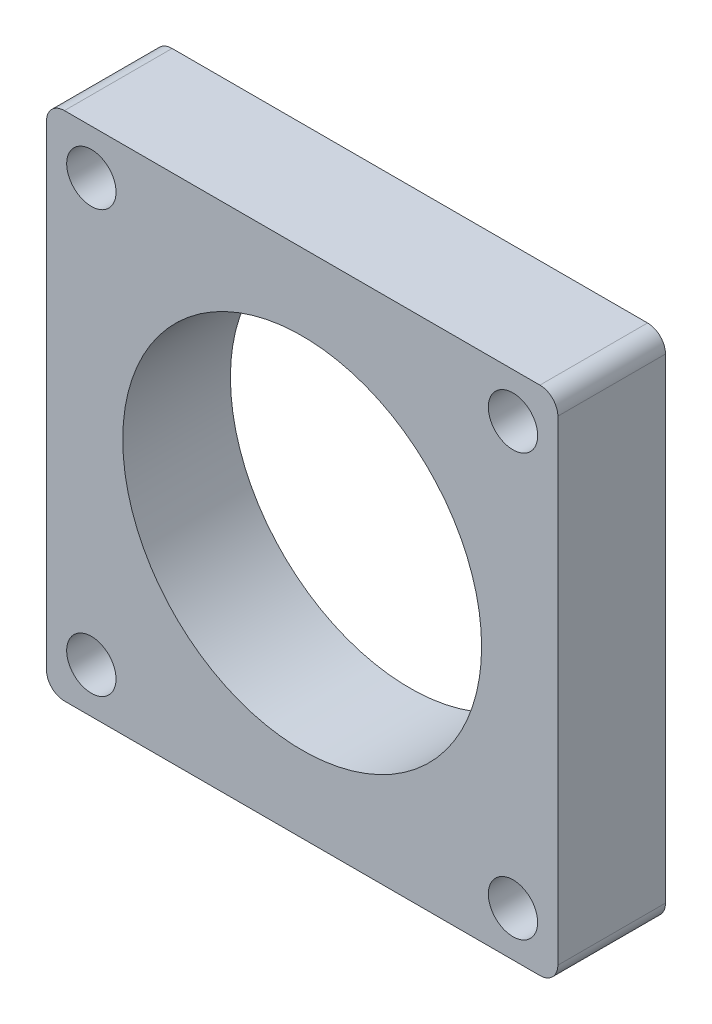
from build123d import *

# Parameters (mm, degrees)
SKETCH1_W           = 57
SKETCH1_H           = 57
SKETCH1_R           = 2.75
SKETCH1_R_2         = 20
BOSS_EXTRUDE1_DEPTH = 12
FILLET1_R           = 2


with BuildPart() as part:
    # Sketch1 → Boss-Extrude1 (new body)
    with BuildSketch(Plane.XY):
        Rectangle(SKETCH1_W, SKETCH1_H)
        with Locations((-23.500001062, 23.500001062)):
            Circle(SKETCH1_R, mode=Mode.SUBTRACT)
        with Locations((23.499998938, 23.499998938)):
            Circle(SKETCH1_R, mode=Mode.SUBTRACT)
        with Locations((23.500001062, -23.500001062)):
            Circle(SKETCH1_R, mode=Mode.SUBTRACT)
        with Locations((-23.499998938, -23.499998938)):
            Circle(SKETCH1_R, mode=Mode.SUBTRACT)
        Circle(SKETCH1_R_2, mode=Mode.SUBTRACT)
    extrude(amount=BOSS_EXTRUDE1_DEPTH)

    # Fillet1
    fillet1_edges = [part.edges().sort_by_distance(p)[0] for p in [
        (28.5, -28.5, 6),
        (-28.5, -28.5, 6),
        (-28.5, 28.5, 6),
        (28.5, 28.5, 6),
    ]]
    fillet(fillet1_edges, radius=FILLET1_R)


solid = part.part
